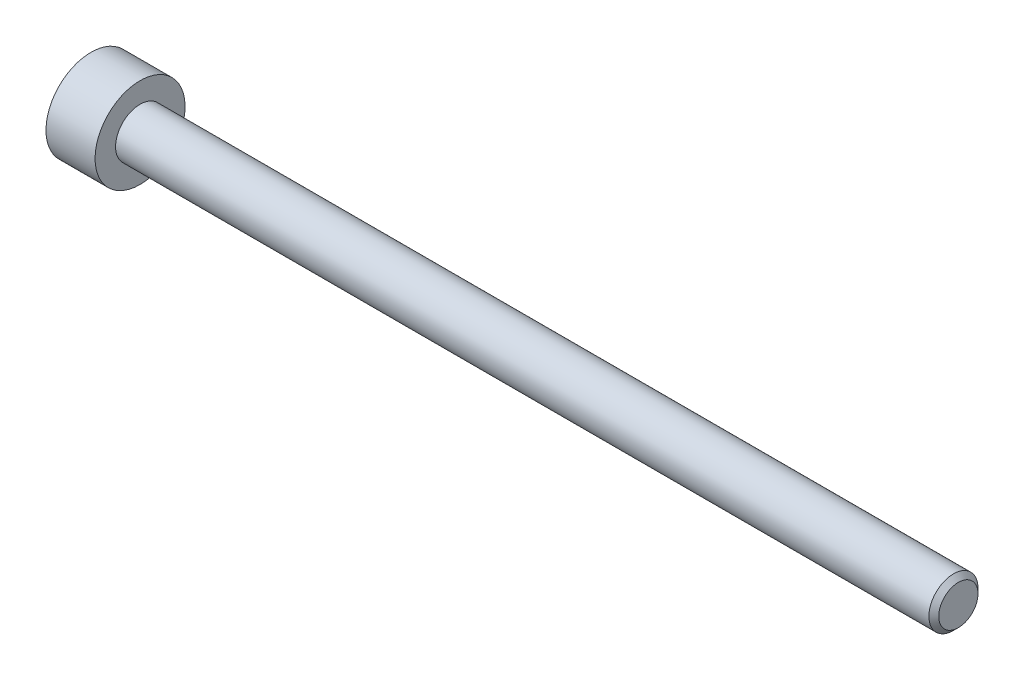
from build123d import *

# Parameters (mm, degrees)
SKETCH2_R           = 1.5
BOSS_EXTRUDE1_DEPTH = 50
CHAMFER1_SIZE       = 0.3
SKETCH6_W           = 3
SKETCH6_H           = 2.75
CUT_EXTRUDE1_DEPTH  = 1.6
SKETCH8_R           = 1.493375673
CUT_EXTRUDE2_DEPTH  = 1
CUT_EXTRUDE2_DRAFT  = -45


with BuildPart() as part:
    # Sketch2 → Boss-Extrude1 (new body)
    with BuildSketch(Plane(origin=(0, 0, 0), x_dir=(0, 0, -1), z_dir=(1, 0, 0))):
        Circle(SKETCH2_R)
    extrude(amount=-BOSS_EXTRUDE1_DEPTH)

    # Chamfer1
    chamfer1_edges = [part.edges().sort_by_distance(p)[0] for p in [
        (0, 0, 1.5),
    ]]
    chamfer(chamfer1_edges, length=CHAMFER1_SIZE)

    # Sketch6 → Revolve1 (revolve)
    with BuildSketch(Plane.XY, mode=Mode.PRIVATE) as revolve1_sk:
        with Locations((-51.5, 1.375)):
            Rectangle(SKETCH6_W, SKETCH6_H)
    revolve(revolve1_sk.sketch.rotate(Axis((-50, 0, 0), (1, 0, 0)), 180), axis=Axis((-50, 0, 0), (1, 0, 0)))

    # Sketch7 → Cut-Extrude1 (cut)
    with BuildSketch(Plane.ZY.offset(53)):
        Polygon((0, 1.443375673), (-1.25, 0.721687836), (-1.25, -0.721687836), (0, -1.443375673), (1.25, -0.721687836), (1.25, 0.721687836), align=None)
    extrude(amount=-CUT_EXTRUDE1_DEPTH, mode=Mode.SUBTRACT)


with BuildPart() as cut_extrude2_tool:
    # Sketch8 → Cut-Extrude2 (with draft: the straight prism first)
    with BuildSketch(Plane.ZY.offset(53)):
        Circle(SKETCH8_R)
    extrude(amount=-CUT_EXTRUDE2_DEPTH)
    # Cut-Extrude2: the draft: its side faces are tilted about the plane it starts from
    cut_extrude2_sides = [cut_extrude2_tool.faces().sort_by_distance(p)[0] for p in [
        (-52.5, 0, -1.493375673),
    ]]
    draft(cut_extrude2_sides, Plane.ZY.offset(53), CUT_EXTRUDE2_DRAFT)


with BuildPart() as part_1:
    add(part.part)

    # Cut-Extrude2: cut by cut_extrude2_tool
    add(cut_extrude2_tool.part, mode=Mode.SUBTRACT)


solid = part_1.part
